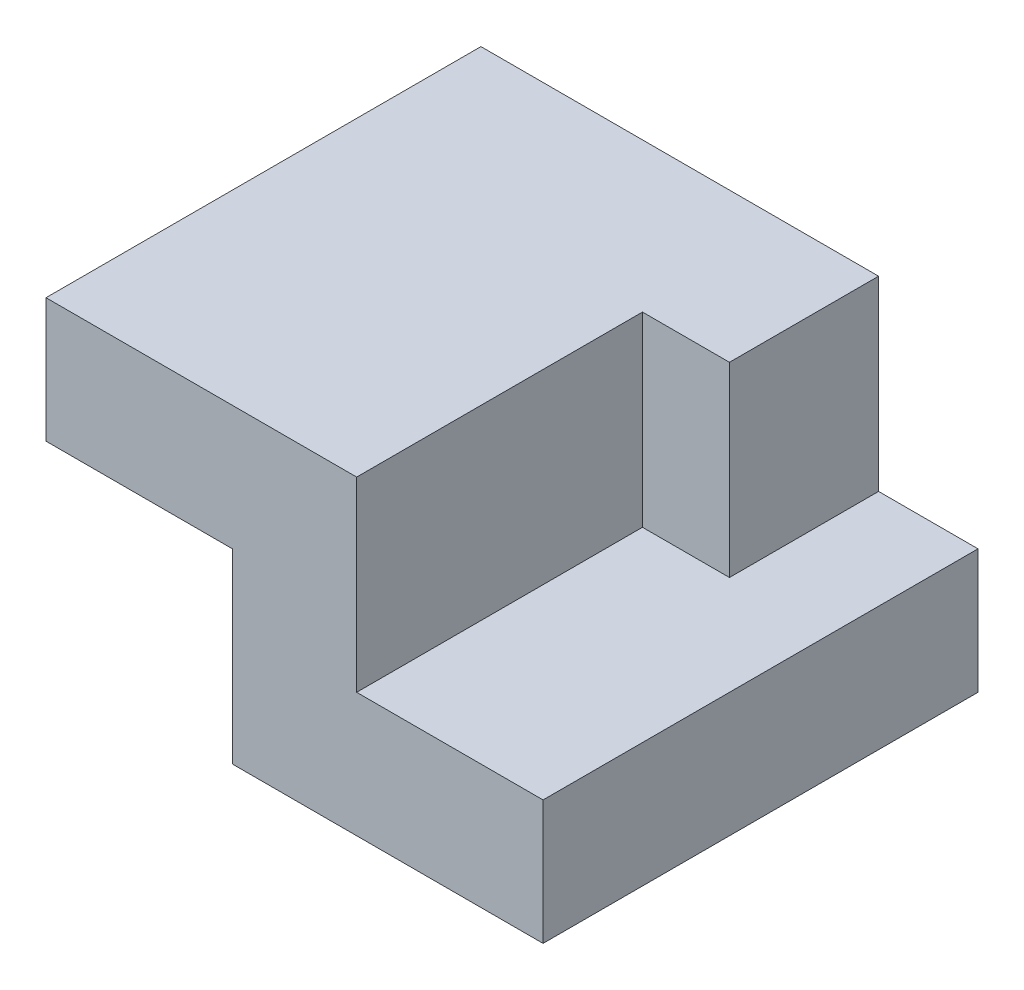
from build123d import *

# Parameters (mm, degrees)
BOSS_EXTRUDE1_DEPTH = 70
SKETCH2_W           = 24
SKETCH2_H           = 30
BOSS_EXTRUDE2_DEPTH = 14


with BuildPart() as part:
    # Sketch1 → Boss-Extrude1 (new body)
    with BuildSketch(Plane.XY):
        Polygon((-8.920310293, 75.855232132), (-58.920310293, 75.855232132), (-58.920310293, 55.855232132), (-28.920310293, 55.855232132), (-28.920310293, 25.855232132), (21.079689707, 25.855232132), (21.079689707, 45.855232132), (-8.920310293, 45.855232132), align=None)
    extrude(amount=BOSS_EXTRUDE1_DEPTH)

    # Sketch2 → Boss-Extrude2 (add)
    with BuildSketch(Plane(origin=(-8.920310293, 0, 0), x_dir=(0, 0, -1), z_dir=(1, 0, 0))):
        with Locations((-12, 60.855232132)):
            Rectangle(SKETCH2_W, SKETCH2_H)
    extrude(amount=BOSS_EXTRUDE2_DEPTH)


solid = part.part
